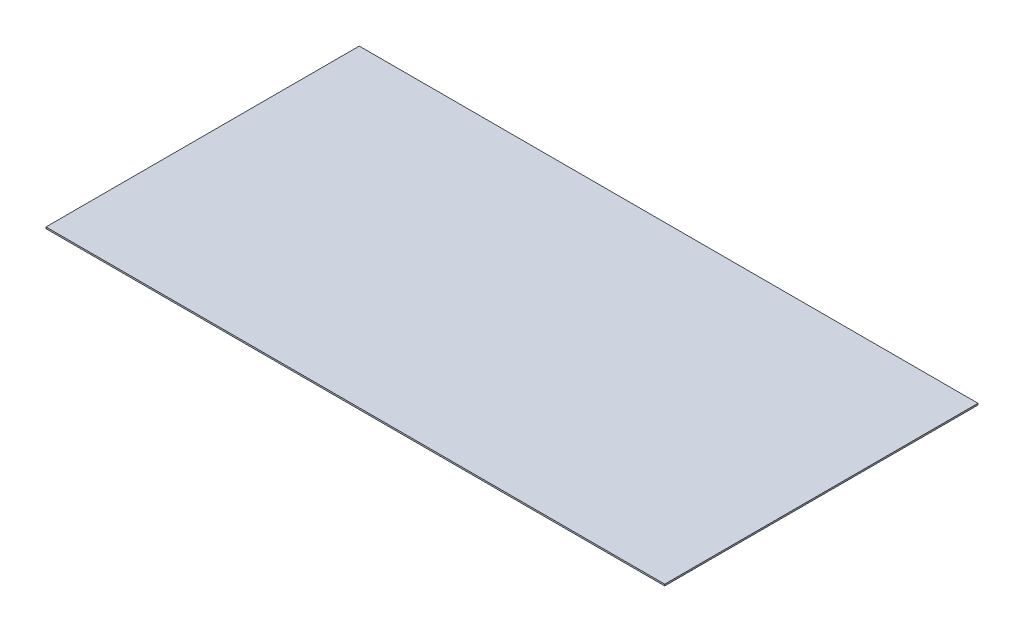
from build123d import *

# Parameters (mm, degrees)
SKETCH1_W          = 395
SKETCH1_H          = 200
CUT_EXTRUDE1_DEPTH = 1


with BuildPart() as part:
    # Sketch1 → Cut-Extrude1 (new body)
    with BuildSketch(Plane(origin=(0, 0, 0), x_dir=(1, 0, 0), z_dir=(0, 1, 0))):
        with Locations((197.5, 0)):
            Rectangle(SKETCH1_W, SKETCH1_H)
    extrude(amount=CUT_EXTRUDE1_DEPTH)


solid = part.part
